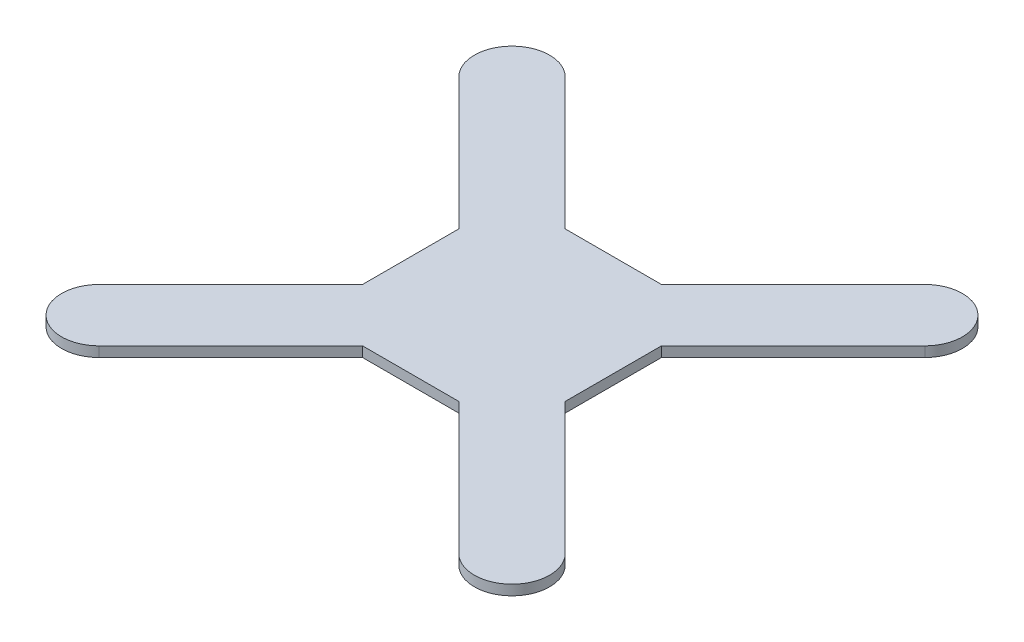
from build123d import *

# Parameters (mm, degrees)
SKETCH1_W           = 200
SKETCH1_H           = 200
BOSS_EXTRUDE1_DEPTH = 10


with BuildPart() as part:
    # Sketch1 → Boss-Extrude1 (new body)
    with BuildSketch(Plane(origin=(0, 0, 0), x_dir=(1, 0, 0), z_dir=(0, 1, 0))):
        with Locations((230, -230)):
            Rectangle(SKETCH1_W, SKETCH1_H)
        with BuildLine():
            Line((130, -330), (130, -277.5))
            Line((130, -277.5), (0, -407.5))
            ThreePointArc((0, -407.5), (0, -460), (52.5, -460))
            Line((52.5, -460), (182.5, -330))
            Line((182.5, -330), (130, -330))
        make_face()
        with BuildLine():
            Line((130, -130), (182.5, -130))
            Line((182.5, -130), (52.5, 0))
            ThreePointArc((52.5, 0), (0, 0), (0, -52.5))
            Line((0, -52.5), (130, -182.5))
            Line((130, -182.5), (130, -130))
        make_face()
        with BuildLine():
            Line((407.5, 0), (277.5, -130))
            Line((277.5, -130), (330, -130))
            Line((330, -130), (330, -182.5))
            Line((330, -182.5), (460, -52.5))
            ThreePointArc((460, -52.5), (460, 0), (407.5, 0))
        make_face()
        with BuildLine():
            Line((460, -407.5), (330, -277.5))
            Line((330, -277.5), (330, -330))
            Line((330, -330), (277.5, -330))
            Line((277.5, -330), (407.5, -460))
            ThreePointArc((407.5, -460), (460, -460), (460, -407.5))
        make_face()
    extrude(amount=BOSS_EXTRUDE1_DEPTH)


solid = part.part
